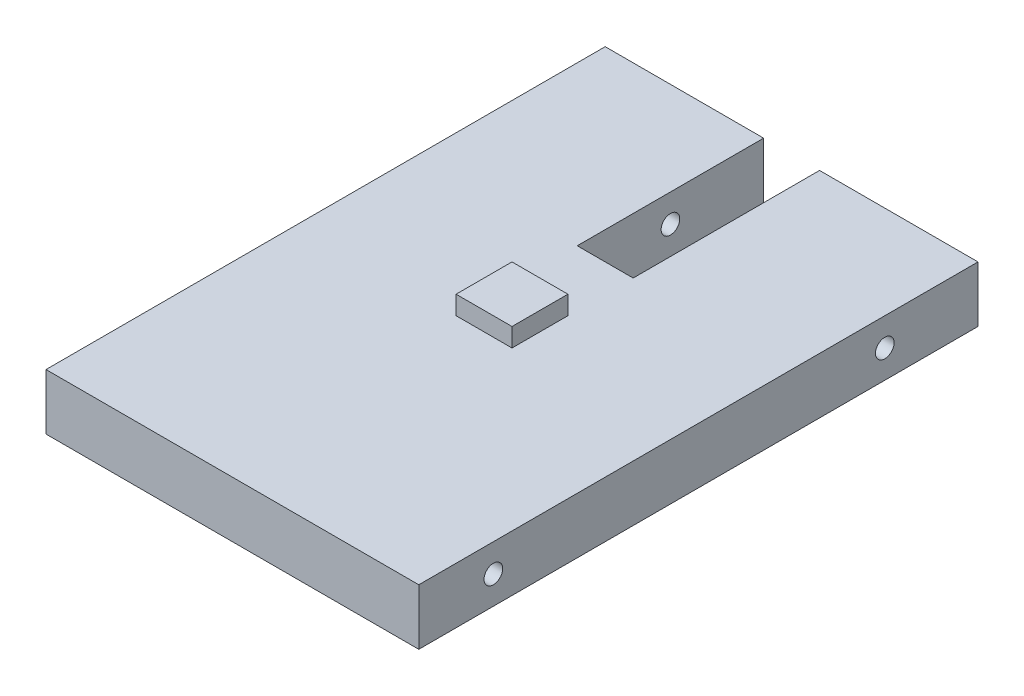
from build123d import *

# Parameters (mm, degrees)
EXTRUDE_1_DEPTH     = 30
SKETCH_2_R          = 5
CUT_EXTRUDE_1_DEPTH = 335
SKETCH_3_W          = 30
SKETCH_3_H          = 30
EXTRUDE_2_DEPTH     = 10


with BuildPart() as part:
    # 草圖1 → 填料-伸長1 (new body)
    with BuildSketch(Plane(origin=(0, 0, 0), x_dir=(1, 0, 0), z_dir=(0, 1, 0))):
        Polygon((-100, -150), (100, -150), (100, 150), (15, 150), (15, 50), (-15, 50), (-15, 150), (-100, 150), align=None)
    extrude(amount=EXTRUDE_1_DEPTH)

    # 草圖2 → 除料-伸長1 (cut)
    with BuildSketch(Plane.ZY.offset(100)):
        with Locations((-100, 15)):
            Circle(SKETCH_2_R)
        with Locations((110, 15)):
            Circle(SKETCH_2_R)
    extrude(amount=-CUT_EXTRUDE_1_DEPTH, mode=Mode.SUBTRACT)

    # 草圖3 → 填料-伸長2 (add)
    with BuildSketch(Plane(origin=(0, 30, 0), x_dir=(1, 0, 0), z_dir=(0, 1, 0))):
        Rectangle(SKETCH_3_W, SKETCH_3_H)
    extrude(amount=EXTRUDE_2_DEPTH)


solid = part.part
